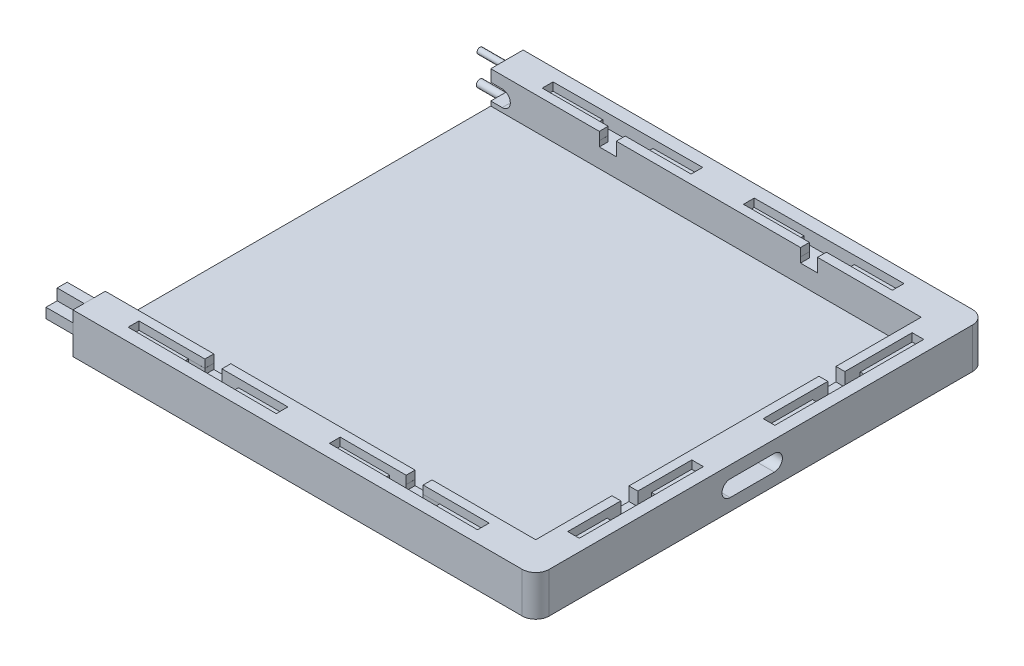
from build123d import *

# Parameters (mm, degrees)
SKETCH1_W           = 159.54
SKETCH1_H           = 142.875
BOSS_EXTRUDE1_DEPTH = 3
BOSS_EXTRUDE2_DEPTH = 15
CUT_EXTRUDE1_DEPTH  = 3
CUT_EXTRUDE2_DEPTH  = 2
CUT_EXTRUDE3_DEPTH  = 12
CUT_EXTRUDE4_DEPTH  = 12
SKETCH8_R           = 1.1
SKETCH8_R_2         = 1.35
BOSS_EXTRUDE3_DEPTH = 10
BOSS_EXTRUDE5_DEPTH = 10
FILLET3_R           = 5
FILLET4_R           = 5


with BuildPart() as part:
    # Sketch1 → Boss-Extrude1 (new body)
    with BuildSketch(Plane(origin=(0, 0, 0), x_dir=(1, 0, 0), z_dir=(0, 1, 0))):
        with Locations((79.77, 0)):
            Rectangle(SKETCH1_W, SKETCH1_H)
    extrude(amount=BOSS_EXTRUDE1_DEPTH)

    # Sketch3 → Boss-Extrude2 (add)
    with BuildSketch(Plane(origin=(0, 0, 0), x_dir=(1, 0, 0), z_dir=(0, 1, 0))):
        Polygon((0, 71.4375), (0, 83.4375), (171.54, 83.4375), (171.54, -83.4375), (0, -83.4375), (0, -71.4375), (159.54, -71.4375), (159.54, 71.4375), align=None)
    extrude(amount=BOSS_EXTRUDE2_DEPTH)

    # Sketch4 → Cut-Extrude1 (cut)
    with BuildSketch(Plane(origin=(0, 15, 0), x_dir=(1, 0, 0), z_dir=(0, 1, 0))):
        Polygon((46.52, 74.7375), (46.52, 71.4375), (40.22, 71.4375), (40.22, 74.735860656), (15.770004479, 74.735860656), (15.770004479, 78.735860656), (70.969180322, 79.037499922), (70.97, 74.7375), align=None)
        Polygon((121.11, 74.7375), (121.11, 71.4375), (114.81, 71.4375), (114.81, 74.735860656), (90.360004479, 74.735860656), (90.360004479, 78.735860656), (145.559180322, 79.037499922), (145.56, 74.7375), align=None)
        Polygon((145.56, -74.7375), (121.11, -74.7375), (121.11, -71.4375), (114.81, -71.4375), (114.81, -74.735860656), (90.360004479, -74.735860656), (90.360004479, -78.735860656), (145.559180322, -79.037499922), align=None)
        Polygon((70.97, -74.7375), (46.52, -74.7375), (46.52, -71.4375), (40.22, -71.4375), (40.22, -74.735860656), (15.770004479, -74.735860656), (15.770004479, -78.735860656), (70.969180322, -79.037499922), align=None)
        Polygon((159.54, -36.8875), (162.84, -36.8875), (162.84, -16.8875), (167.14, -16.8875), (167.14, -62.8875), (162.84, -62.8875), (162.84, -43.1875), (159.54, -43.1875), align=None)
        Polygon((159.54, 39.8375), (162.84, 39.8375), (162.84, 64.788405135), (167.14, 64.788405135), (167.14, 9.588405135), (162.84, 9.588405135), (162.84, 33.5375), (159.54, 33.5375), align=None)
    extrude(amount=-CUT_EXTRUDE1_DEPTH, mode=Mode.SUBTRACT)

    # Sketch5 → Cut-Extrude2 (cut)
    with BuildSketch(Plane(origin=(0, 12, 0), x_dir=(1, 0, 0), z_dir=(0, 1, 0))):
        Polygon((40.226803468, -71.4375), (40.226803468, -74.7375), (34.114303468, -74.7375), (34.114303468, -78.836104198), (52.639026882, -78.93733368), (52.639026882, -74.7375), (46.525702928, -74.7375), (46.525702928, -71.4375), align=None)
        Polygon((114.817365037, -74.735860656), (108.704865037, -74.735860656), (108.704865037, -78.836107266), (127.229588452, -78.937336748), (127.229588452, -74.735860656), (121.117088452, -74.735860656), (121.117088452, -71.4375), (114.817365037, -71.4375), align=None)
        Polygon((114.817365037, 71.4375), (114.817365037, 74.735860656), (108.704865037, 74.735860656), (108.704865037, 78.836107266), (127.229588452, 78.937336748), (127.229588452, 74.735860656), (121.117088452, 74.735860656), (121.117088452, 71.4375), align=None)
        Polygon((46.525702928, 71.4375), (40.226803468, 71.4375), (40.226803468, 74.7375), (34.114303468, 74.7375), (34.114303468, 78.836104198), (52.639026882, 78.93733368), (52.639026882, 74.7375), (46.525702928, 74.7375), align=None)
        Polygon((162.84, -31.8125), (167.14, -31.8125), (167.14, -48.2625), (162.84, -48.2625), (162.84, -43.1875), (159.54, -43.1875), (159.54, -36.8875), (162.84, -36.8875), align=None)
        Polygon((159.54, 39.8375), (162.84, 39.8375), (162.84, 45.524773716), (167.14, 45.524773716), (167.14, 27.850226284), (162.84, 27.850226284), (162.84, 33.5375), (159.54, 33.5375), align=None)
    extrude(amount=-CUT_EXTRUDE2_DEPTH, mode=Mode.SUBTRACT)

    # Sketch6 → Cut-Extrude3 (cut)
    with BuildSketch(Plane(origin=(171.54, 0, 0), x_dir=(0, 0, -1), z_dir=(1, 0, 0))):
        with BuildLine():
            Line((-11.3875, 10.5), (4.9925, 10.5))
            ThreePointArc((4.9925, 10.5), (7.9925, 7.5), (4.9925, 4.5))
            Line((4.9925, 4.5), (-11.3875, 4.5))
            ThreePointArc((-11.3875, 4.5), (-14.3875, 7.5), (-11.3875, 10.5))
        make_face()
    extrude(amount=-CUT_EXTRUDE3_DEPTH, mode=Mode.SUBTRACT)

    # Sketch7 → Cut-Extrude4 (cut)
    with BuildSketch(Plane(origin=(0, 0, -83.4375), x_dir=(-1, 0, 0), z_dir=(0, 0, -1))):
        with BuildLine():
            Line((-4.24, 10.6343), (12.14, 10.6343))
            ThreePointArc((12.14, 10.6343), (15.14, 7.6343), (12.14, 4.6343))
            Line((12.14, 4.6343), (-4.24, 4.6343))
            ThreePointArc((-4.24, 4.6343), (-7.24, 7.6343), (-4.24, 10.6343))
        make_face()
    extrude(amount=-CUT_EXTRUDE4_DEPTH, mode=Mode.SUBTRACT)

    # Sketch8 → Boss-Extrude3 (add)
    with BuildSketch(Plane.ZY):
        with Locations(Location((-77.4375, 12.81715, 0), (0, 0, 180))):
            Circle(SKETCH8_R)
        with Locations(Location((-77.4375, 2.328843142, 0), (0, 0, 180))):
            Circle(SKETCH8_R_2)
    extrude(amount=BOSS_EXTRUDE3_DEPTH)

    # Sketch9 → Boss-Extrude5 (add)
    with BuildSketch(Plane.ZY):
        Polygon((75.5875, 14.9834354), (79.2875, 14.9834354), (79.2875, 10.85), (83.421238753, 10.85), (83.421238753, 7.15), (79.2875, 7.15), (79.2875, 3.0165646), (75.5875, 3.0165646), (75.5875, 7.15000001), (71.454555518, 7.15000001), (71.454180357, 10.84999999), (75.5875, 10.84999999), align=None)
    extrude(amount=BOSS_EXTRUDE5_DEPTH)

    # Fillet3
    fillet3_edges = [part.edges().sort_by_distance(p)[0] for p in [
        (171.54, 7.5, 83.4375),
    ]]
    fillet(fillet3_edges, radius=FILLET3_R)

    # Fillet4
    fillet4_edges = [part.edges().sort_by_distance(p)[0] for p in [
        (171.54, 7.5, -83.4375),
    ]]
    fillet(fillet4_edges, radius=FILLET4_R)


solid = part.part
